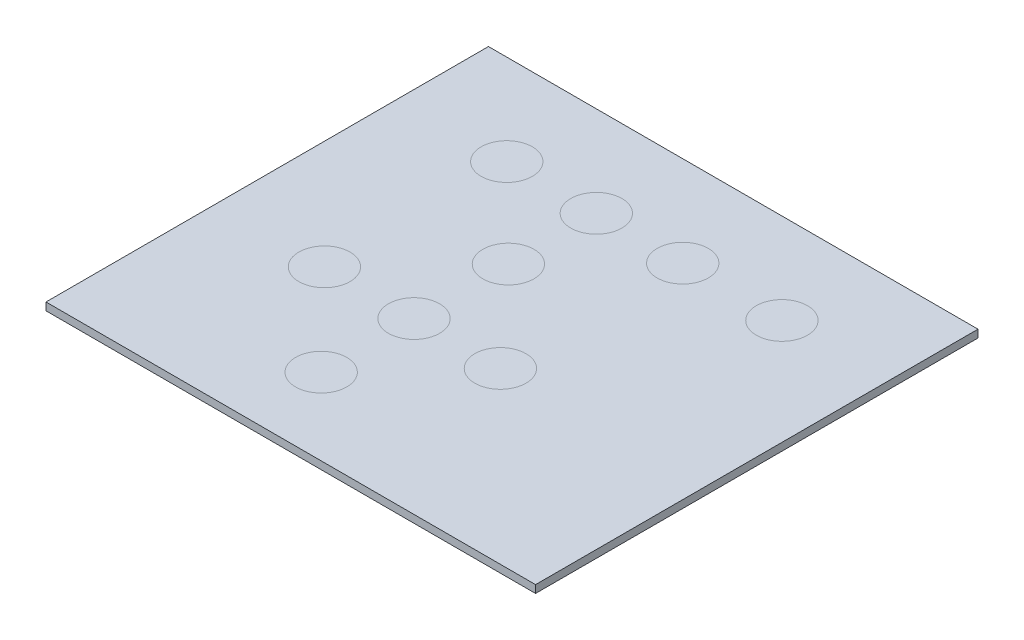
from build123d import *

# Parameters (mm, degrees)
SKETCH1_W           = 76.5
SKETCH1_H           = 69.14
BOSS_EXTRUDE1_DEPTH = 1.2


with BuildPart() as part:
    # Sketch1 → Boss-Extrude1 (new body)
    with BuildSketch(Plane(origin=(0, 0, 0), x_dir=(1, 0, 0), z_dir=(0, 1, 0))):
        Rectangle(SKETCH1_W, SKETCH1_H)
    extrude(amount=BOSS_EXTRUDE1_DEPTH)


solid = part.part
